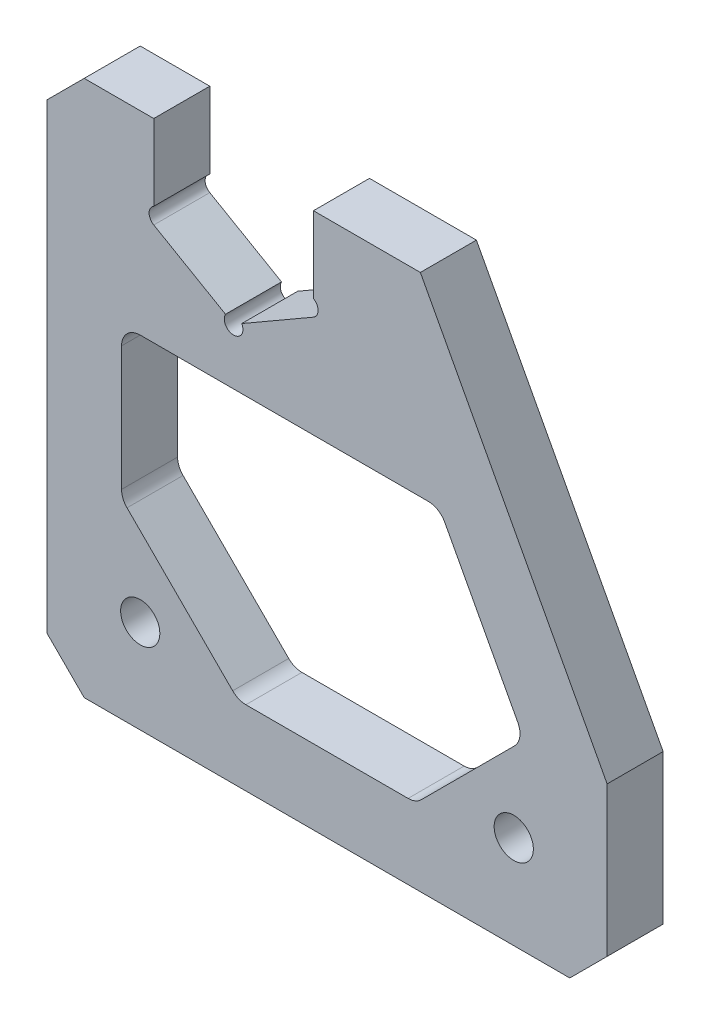
from build123d import *

# Parameters (mm, degrees)
SKETCH_1_R          = 2.1
EXTRUDE_1_DEPTH     = 3
CHAMFER_1_SIZE      = 4
SKETCH_2_R          = 1
CUT_EXTRUDE_1_DEPTH = 67.274052238
CUT_EXTRUDE_2_DEPTH = 67.274052238
FILLET_1_R          = 2
CHAMFER_2_SIZE      = 2


with BuildPart() as part:
    # 草图1 → 凸台-拉伸1 (new, symmetric)
    with BuildSketch(Plane.XY):
        Polygon((-20, 4.936344802), (-20, -52.5), (40, -52.5), (40, -32.5), (20, 4.936344802), (8.55, 4.936344802), (8.55, -4.936344802), (0, -9.872689603), (-8.55, -4.936344802), (-8.55, 4.936344802), align=None)
        with Locations((-10, -42.5)):
            Circle(SKETCH_1_R, mode=Mode.SUBTRACT)
        with Locations((30, -42.5)):
            Circle(SKETCH_1_R, mode=Mode.SUBTRACT)
    extrude(amount=EXTRUDE_1_DEPTH, both=True)

    # 倒角1
    chamfer_1_edges = [part.edges().sort_by_distance(p)[0] for p in [
        (40, -52.5, 0),
        (-20, -52.5, 0),
        (-20, 4.936344802, 0),
    ]]
    chamfer(chamfer_1_edges, length=CHAMFER_1_SIZE)

    # 草图2 → 切除-拉伸1 (cut, through all)
    with BuildSketch(Plane.XY.offset(3)):
        with Locations((-8.05, -4.070319398)):
            Circle(SKETCH_2_R)
        with Locations((8.05, -4.070319398)):
            Circle(SKETCH_2_R)
        with Locations((0, -9.872689603)):
            Circle(SKETCH_2_R)
    extrude(amount=-CUT_EXTRUDE_1_DEPTH, mode=Mode.SUBTRACT)

    # 草图3 → 切除-拉伸2 (cut, through all)
    with BuildSketch(Plane.XY.offset(3)):
        Polygon((-12, -15.872689603), (-12, -32.014718626), (0.485281374, -44.5), (19.514718626, -44.5), (31.133551708, -32.881166917), (22.046939538, -15.872689603), align=None)
    extrude(amount=-CUT_EXTRUDE_2_DEPTH, mode=Mode.SUBTRACT)

    # 圆角1
    fillet_1_edges = [part.edges().sort_by_distance(p)[0] for p in [
        (-12, -15.872689603, 0),
        (22.046939538, -15.872689603, 0),
        (31.133551708, -32.881166917, 0),
        (19.514718626, -44.5, 0),
        (0.485281374, -44.5, 0),
        (-12, -32.014718626, 0),
    ]]
    fillet(fillet_1_edges, radius=FILLET_1_R)

    # 倒角2
    chamfer_2_edges = [part.edges().sort_by_distance(p)[0] for p in [
        (-12.1, -42.5, -3),
        (27.9, -42.5, -3),
    ]]
    chamfer(chamfer_2_edges, length=CHAMFER_2_SIZE)


solid = part.part
